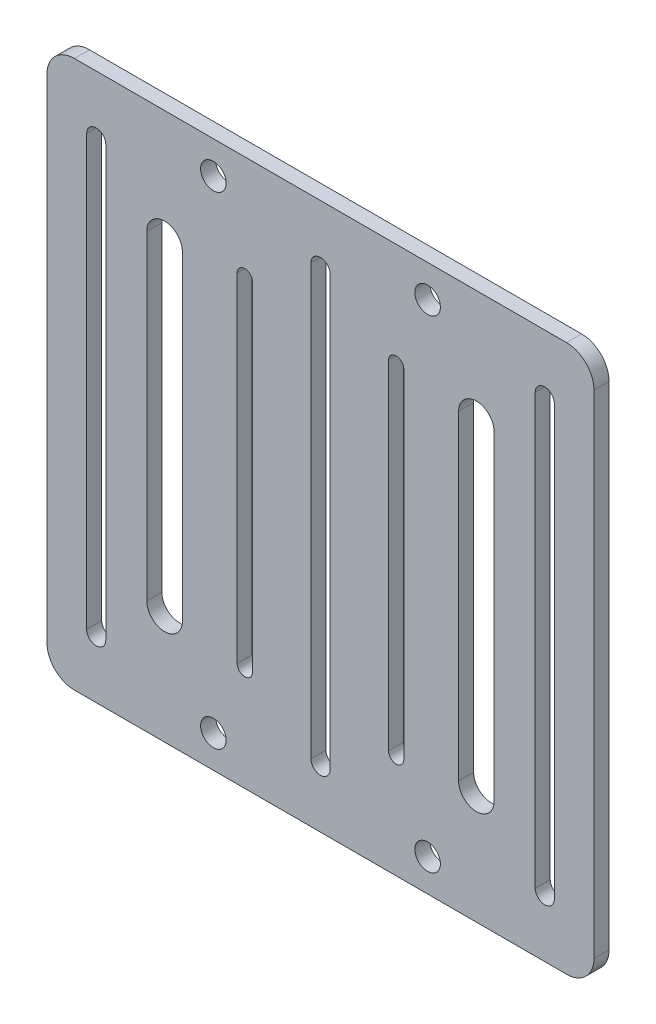
from build123d import *

# Parameters (mm, degrees)
BOSS_EXTRUDE1_DEPTH = 1.65
SKETCH2_R           = 1.4
CUT_EXTRUDE1_DEPTH  = 1.65


with BuildPart() as part:
    # Sketch1 → Boss-Extrude1 (new body)
    with BuildSketch(Plane.XY):
        with BuildLine():
            Line((27, -30), (-27, -30))
            ThreePointArc((-27, -30), (-29.121320344, -29.121320344), (-30, -27))
            Line((-30, -27), (-30, 27))
            ThreePointArc((-30, 27), (-29.121320344, 29.121320344), (-27, 30))
            Line((-27, 30), (27, 30))
            ThreePointArc((27, 30), (29.121320344, 29.121320344), (30, 27))
            Line((30, 27), (30, -27))
            ThreePointArc((30, -27), (29.121320344, -29.121320344), (27, -30))
        make_face()
    extrude(amount=BOSS_EXTRUDE1_DEPTH)

    # Sketch2 → Cut-Extrude1 (cut)
    with BuildSketch(Plane.XY.offset(1.65)):
        with Locations((-11.75, 26.45)):
            Circle(SKETCH2_R)
        with Locations(Location((11.75, 26.45, 0), (0, 0, 180))):
            Circle(SKETCH2_R)
        with Locations((11.75, -26.45)):
            Circle(SKETCH2_R)
        with Locations(Location((-11.75, -26.45, 0), (0, 0, 180))):
            Circle(SKETCH2_R)
        with BuildLine():
            Line((23.551533864, -23.55), (23.551533864, 23.55))
            ThreePointArc((23.551533864, 23.55), (24.6, 24.598466136), (25.648466136, 23.55))
            Line((25.648466136, 23.55), (25.648466136, -23.55))
            ThreePointArc((25.648466136, -23.55), (24.6, -24.598466136), (23.551533864, -23.55))
        make_face()
        with BuildLine():
            Line((-1.048466136, -23.55), (-1.048466136, 23.55))
            ThreePointArc((-1.048466136, 23.55), (0, 24.598466136), (1.048466136, 23.55))
            Line((1.048466136, 23.55), (1.048466136, -23.55))
            ThreePointArc((1.048466136, -23.55), (0, -24.598466136), (-1.048466136, -23.55))
        make_face()
        with BuildLine():
            Line((-25.648466136, -23.55), (-25.648466136, 23.55))
            ThreePointArc((-25.648466136, 23.55), (-24.6, 24.598466136), (-23.551533864, 23.55))
            Line((-23.551533864, 23.55), (-23.551533864, -23.55))
            ThreePointArc((-23.551533864, -23.55), (-24.6, -24.598466136), (-25.648466136, -23.55))
        make_face()
        with BuildLine():
            Line((-9.13875967, -18.55), (-9.13875967, 18.55))
            ThreePointArc((-9.13875967, 18.55), (-8.3, 19.38875967), (-7.46124033, 18.55))
            Line((-7.46124033, 18.55), (-7.46124033, -18.55))
            ThreePointArc((-7.46124033, -18.55), (-8.3, -19.38875967), (-9.13875967, -18.55))
        make_face()
        with BuildLine():
            Line((15.15, -17.55), (15.15, 17.55))
            ThreePointArc((15.15, 17.55), (17.1, 19.5), (19.05, 17.55))
            Line((19.05, 17.55), (19.05, -17.55))
            ThreePointArc((19.05, -17.55), (17.1, -19.5), (15.15, -17.55))
        make_face()
        with BuildLine():
            Line((-19.05, -17.55), (-19.05, 17.55))
            ThreePointArc((-19.05, 17.55), (-17.1, 19.5), (-15.15, 17.55))
            Line((-15.15, 17.55), (-15.15, -17.55))
            ThreePointArc((-15.15, -17.55), (-17.1, -19.5), (-19.05, -17.55))
        make_face()
        with BuildLine():
            Line((7.46124033, -18.55), (7.46124033, 18.55))
            ThreePointArc((7.46124033, 18.55), (8.3, 19.38875967), (9.13875967, 18.55))
            Line((9.13875967, 18.55), (9.13875967, -18.55))
            ThreePointArc((9.13875967, -18.55), (8.3, -19.38875967), (7.46124033, -18.55))
        make_face()
    extrude(amount=-CUT_EXTRUDE1_DEPTH, mode=Mode.SUBTRACT)


solid = part.part
